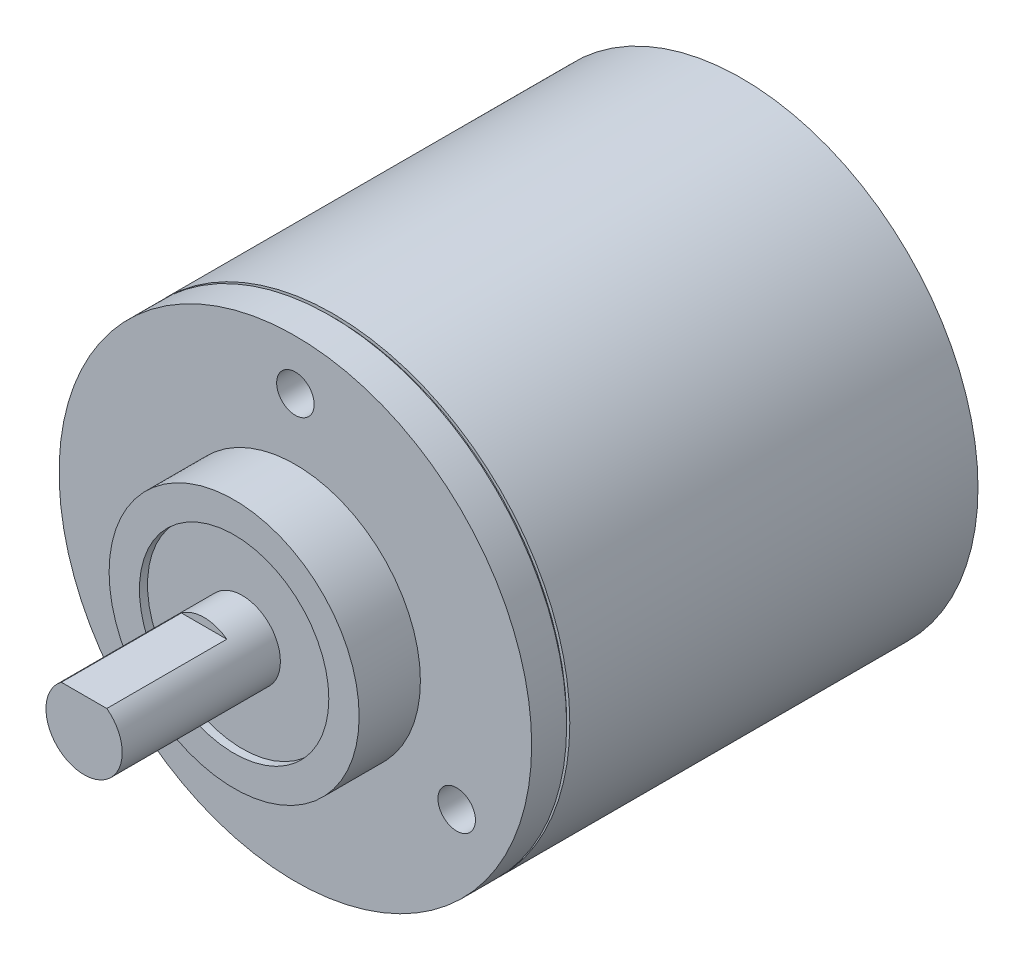
from build123d import *

# Parameters (mm, degrees)
BOSS_EXTRU_1_DEPTH           = 35.6
BOSS_EXTRU_1_DEPTH_BACK      = 0.1
ESQUISSE1_R                  = 18.9
ESQUISSE3_R                  = 10
BOSS_EXTRU_3_DEPTH           = 4.9
ESQUISSE4_R                  = 3.05
BOSS_EXTRU_4_DEPTH           = 12
ESQUISSE5_R                  = 1.5
ENL_V_MAT_EXTRU_1_DEPTH      = 8
ENL_V_START                  = -0.65
ESQUISSE6_R                  = 7.575
ESQUISSE6_R_2                = 3.05
ENL_V_MAT_EXTRU_3_DEPTH      = 0.65
ENL_V_MAT_EXTRU_4_DEPTH      = 9.6
R_P_TITION_CIRCULAIRE1_COUNT = 3
ESQUISSE8_W                  = 0.25
ESQUISSE8_H                  = 3.196164938


with BuildPart() as part:
    # Esquisse1 → Boss.-Extru.1 (new, two sides: drawn at the far end of the back side and taken through both)
    with BuildSketch(Plane.XY.offset(-BOSS_EXTRU_1_DEPTH_BACK)):
        Circle(ESQUISSE1_R)
    extrude(amount=BOSS_EXTRU_1_DEPTH + BOSS_EXTRU_1_DEPTH_BACK)

    # Esquisse3 → Boss.-Extru.3 (add)
    with BuildSketch(Plane.XY.offset(35.6)):
        Circle(ESQUISSE3_R)
    extrude(amount=BOSS_EXTRU_3_DEPTH)

    # Esquisse4 → Boss.-Extru.4 (add)
    with BuildSketch(Plane.XY.offset(40.5)):
        Circle(ESQUISSE4_R)
    extrude(amount=BOSS_EXTRU_4_DEPTH)

    # Esquisse5 → Enlèv. mat.-Extru.1 (cut)
    with BuildSketch(Plane.XY.offset(35.6)):
        with Locations((0, 14.9)):
            Circle(ESQUISSE5_R)
    enl_v_mat_extru_1 = extrude(amount=-ENL_V_MAT_EXTRU_1_DEPTH, mode=Mode.SUBTRACT)

    # Esquisse6 → Enlèv. mat.-Extru.3 (cut)
    with BuildSketch(Plane.XY.offset(40.5).offset(ENL_V_START)):
        Circle(ESQUISSE6_R)
        Circle(ESQUISSE6_R_2, mode=Mode.SUBTRACT)
    extrude(amount=ENL_V_MAT_EXTRU_3_DEPTH, mode=Mode.SUBTRACT)

    # Esquisse7 → Enlèv. mat.-Extru.4 (cut)
    with BuildSketch(Plane.XY.offset(52.5)):
        Polygon((-4.317069663, 2.45), (4.517863601, 2.45), (1.480855292, 5.48700831), (-3.363298459, 5.48700831), align=None)
    extrude(amount=-ENL_V_MAT_EXTRU_4_DEPTH, mode=Mode.SUBTRACT)

    # Répétition circulaire1: Enlèv. mat.-Extru.1 ×3 about axis
    r_p_tition_circulaire1_axis = Axis((0, 0, 0), (0, 0, 1))
    for i in range(1, R_P_TITION_CIRCULAIRE1_COUNT):
        add(enl_v_mat_extru_1.rotate(r_p_tition_circulaire1_axis, i * 360 / R_P_TITION_CIRCULAIRE1_COUNT), mode=Mode.SUBTRACT)

    # Esquisse8 → Enlèvement de matière-Révolution1 (revolve, cut)
    with BuildSketch(Plane(origin=(0, 0, 0), x_dir=(0, 0, -1), z_dir=(1, 0, 0)), mode=Mode.PRIVATE) as enl_vement_de_mati_re_r_volution1_sk:
        with Locations((-32.675, 20.248082469)):
            Rectangle(ESQUISSE8_W, ESQUISSE8_H)
    revolve(enl_vement_de_mati_re_r_volution1_sk.sketch.rotate(Axis((0, 0, -0.1), (0, 0, 1)), 270), axis=Axis((0, 0, -0.1), (0, 0, 1)), mode=Mode.SUBTRACT)


solid = part.part
